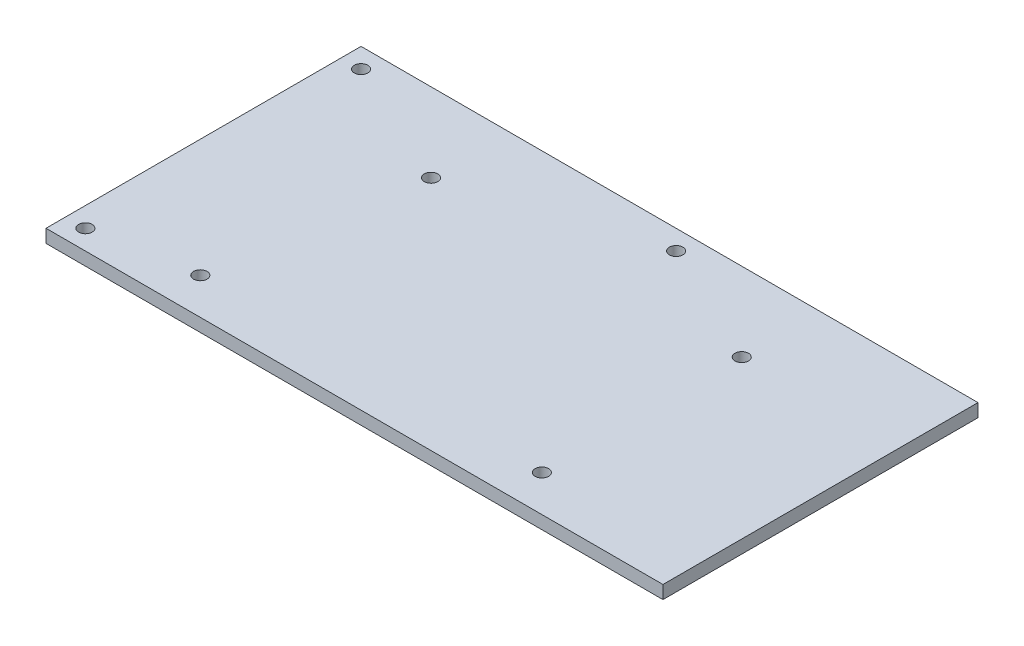
from build123d import *

# Parameters (mm, degrees)
BASE_SKETCH_W                              = 149.225
BASE_SKETCH_H                              = 76.2
BOSS_EXTRUDE1_DEPTH                        = 3.175
CUT_EXTRUDE1_REACH                         = 85.837
F_4_40_HOLE_PATTERN_SKETCH_GUIDE_RAIL_R    = 1.63195
CUT_EXTRUDE2_REACH                         = 85.837
F_4_40_HOLE_PATTERN_SKETCH_ARDUINO_HOLES_R = 1.63195


with BuildPart() as part:
    # Base Sketch → Boss-Extrude1 (new body)
    with BuildSketch(Plane(origin=(0, 0, 0), x_dir=(1, 0, 0), z_dir=(0, 1, 0))):
        Rectangle(BASE_SKETCH_W, BASE_SKETCH_H)
    extrude(amount=BOSS_EXTRUDE1_DEPTH)

    # 4-40 Hole Pattern Sketch (Guide Rail) → Cut-Extrude1 (cut, up to next)
    with BuildSketch(Plane(origin=(0, 3.175, 0), x_dir=(1, 0, 0), z_dir=(0, 1, 0)), mode=Mode.PRIVATE) as cut_extrude1_sk1:
        with Locations(Location((-69.85, 33.3375, 0), (0, 0, 270))):
            Circle(F_4_40_HOLE_PATTERN_SKETCH_GUIDE_RAIL_R)
    cut_extrude1_tool1 = extrude(cut_extrude1_sk1.sketch, amount=-CUT_EXTRUDE1_REACH, mode=Mode.PRIVATE) & part.part
    # 4-40 Hole Pattern Sketch (Guide Rail) → Cut-Extrude1 (cut, up to next)
    with BuildSketch(Plane(origin=(0, 3.175, 0), x_dir=(1, 0, 0), z_dir=(0, 1, 0)), mode=Mode.PRIVATE) as cut_extrude1_sk2:
        with Locations(Location((6.35, 33.3375, 0), (0, 0, 270))):
            Circle(F_4_40_HOLE_PATTERN_SKETCH_GUIDE_RAIL_R)
    cut_extrude1_tool2 = extrude(cut_extrude1_sk2.sketch, amount=-CUT_EXTRUDE1_REACH, mode=Mode.PRIVATE) & part.part
    # 4-40 Hole Pattern Sketch (Guide Rail) → Cut-Extrude1 (cut, up to next)
    with BuildSketch(Plane(origin=(0, 3.175, 0), x_dir=(1, 0, 0), z_dir=(0, 1, 0)), mode=Mode.PRIVATE) as cut_extrude1_sk3:
        with Locations(Location((-69.85, -33.3375, 0), (0, 0, 270))):
            Circle(F_4_40_HOLE_PATTERN_SKETCH_GUIDE_RAIL_R)
    cut_extrude1_tool3 = extrude(cut_extrude1_sk3.sketch, amount=-CUT_EXTRUDE1_REACH, mode=Mode.PRIVATE) & part.part
    add(cut_extrude1_tool1.solids().sort_by_distance((-69.85, 3.175, -33.3375))[0], mode=Mode.SUBTRACT)
    add(cut_extrude1_tool2.solids().sort_by_distance((6.35, 3.175, -33.3375))[0], mode=Mode.SUBTRACT)
    add(cut_extrude1_tool3.solids().sort_by_distance((-69.85, 3.175, 33.3375))[0], mode=Mode.SUBTRACT)

    # 4-40 Hole Pattern Sketch (Arduino Holes) → Cut-Extrude2 (cut, up to next)
    with BuildSketch(Plane(origin=(0, 3.175, 0), x_dir=(1, 0, 0), z_dir=(0, 1, 0)), mode=Mode.PRIVATE) as cut_extrude2_sk1:
        with Locations(Location((-38.6207, 19.05, 0), (0, 0, 270))):
            Circle(F_4_40_HOLE_PATTERN_SKETCH_ARDUINO_HOLES_R)
    cut_extrude2_tool1 = extrude(cut_extrude2_sk1.sketch, amount=-CUT_EXTRUDE2_REACH, mode=Mode.PRIVATE) & part.part
    # 4-40 Hole Pattern Sketch (Arduino Holes) → Cut-Extrude2 (cut, up to next)
    with BuildSketch(Plane(origin=(0, 3.175, 0), x_dir=(1, 0, 0), z_dir=(0, 1, 0)), mode=Mode.PRIVATE) as cut_extrude2_sk2:
        with Locations(Location((-46.1137, -29.2862, 0), (0, 0, 270))):
            Circle(F_4_40_HOLE_PATTERN_SKETCH_ARDUINO_HOLES_R)
    cut_extrude2_tool2 = extrude(cut_extrude2_sk2.sketch, amount=-CUT_EXTRUDE2_REACH, mode=Mode.PRIVATE) & part.part
    # 4-40 Hole Pattern Sketch (Arduino Holes) → Cut-Extrude2 (cut, up to next)
    with BuildSketch(Plane(origin=(0, 3.175, 0), x_dir=(1, 0, 0), z_dir=(0, 1, 0)), mode=Mode.PRIVATE) as cut_extrude2_sk3:
        with Locations(Location((36.5125, -29.2862, 0), (0, 0, 270))):
            Circle(F_4_40_HOLE_PATTERN_SKETCH_ARDUINO_HOLES_R)
    cut_extrude2_tool3 = extrude(cut_extrude2_sk3.sketch, amount=-CUT_EXTRUDE2_REACH, mode=Mode.PRIVATE) & part.part
    # 4-40 Hole Pattern Sketch (Arduino Holes) → Cut-Extrude2 (cut, up to next)
    with BuildSketch(Plane(origin=(0, 3.175, 0), x_dir=(1, 0, 0), z_dir=(0, 1, 0)), mode=Mode.PRIVATE) as cut_extrude2_sk4:
        with Locations(Location((36.5125, 19.05, 0), (0, 0, 270))):
            Circle(F_4_40_HOLE_PATTERN_SKETCH_ARDUINO_HOLES_R)
    cut_extrude2_tool4 = extrude(cut_extrude2_sk4.sketch, amount=-CUT_EXTRUDE2_REACH, mode=Mode.PRIVATE) & part.part
    add(cut_extrude2_tool1.solids().sort_by_distance((-38.6207, 3.175, -19.05))[0], mode=Mode.SUBTRACT)
    add(cut_extrude2_tool2.solids().sort_by_distance((-46.1137, 3.175, 29.2862))[0], mode=Mode.SUBTRACT)
    add(cut_extrude2_tool3.solids().sort_by_distance((36.5125, 3.175, 29.2862))[0], mode=Mode.SUBTRACT)
    add(cut_extrude2_tool4.solids().sort_by_distance((36.5125, 3.175, -19.05))[0], mode=Mode.SUBTRACT)


solid = part.part
